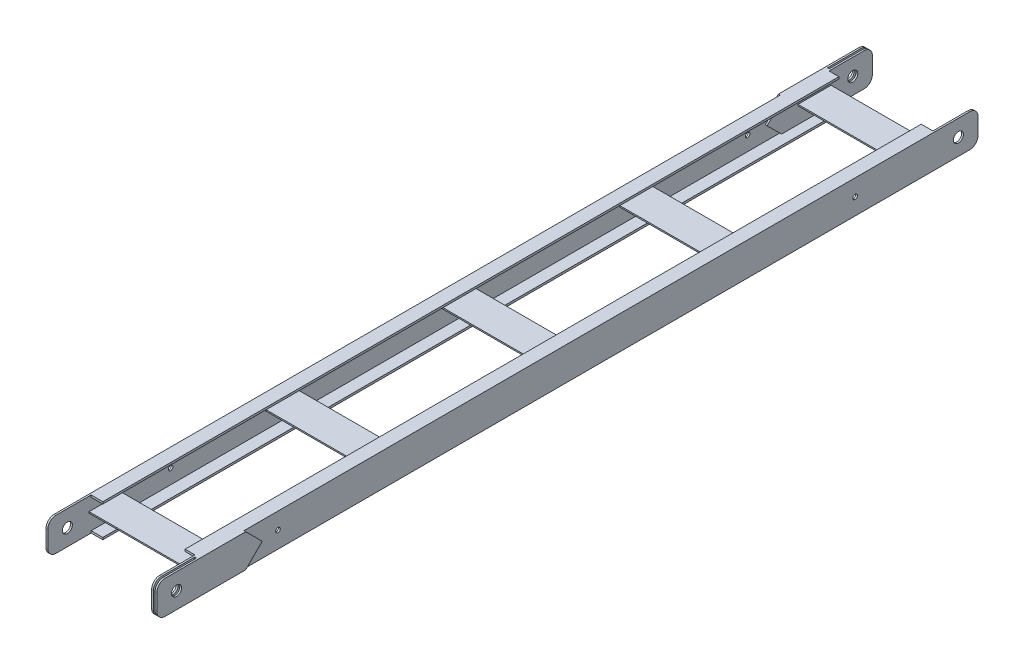
from build123d import *

# Parameters (mm, degrees)
EXTRUDE_1_DEPTH        = 3985
EXTRUDE_1_2_DEPTH      = 3985
EXTRUDE_3_DEPTH        = 520
SKETCH_6_W             = 511.5
SKETCH_6_H             = 200
CUT_EXTRUDE_4_DEPTH    = 4024.075595859
PATTERN_LINEAR_1_COUNT = 5
PATTERN_LINEAR_1_PITCH = 856.25
EXTRUDE_11_DEPTH       = 8.5
PATTERN_LINEAR_2_COUNT = 2
PATTERN_LINEAR_2_PITCH = 17
SKETCH_22_W            = 8.5
SKETCH_22_H            = 200
CUT_EXTRUDE_12_DEPTH   = 4025.201038716
SKETCH_23_R            = 24.25
CUT_EXTRUDE_13_DEPTH   = 4025.201038716
EXTRUDE_14_DEPTH       = 8.5
PATTERN_LINEAR_3_COUNT = 2
PATTERN_LINEAR_3_PITCH = 17
SKETCH_27_W            = 8.5
SKETCH_27_H            = 200
CUT_EXTRUDE_15_DEPTH   = 4025.201038716
SKETCH_28_R            = 24.25
CUT_EXTRUDE_16_DEPTH   = 4026.344115725
FILLET_2_R             = 40
SKETCH_29_W            = 503
SKETCH_29_H            = 10
CUT_EXTRUDE_17_DEPTH   = 10
SKETCH_30_W            = 503
SKETCH_30_H            = 10
CUT_EXTRUDE_18_DEPTH   = 10
SKETCH_31_R            = 11
CUT_EXTRUDE_19_DEPTH   = 4025.201038716


with BuildPart() as part:
    # 草图2 → 拉伸1 (new body)
    with BuildSketch(Plane.XY):
        Polygon((0, 0), (0, 160), (65, 160), (65, 150), (8.5, 150), (8.5, 10), (65, 10), (65, 0), align=None)
    extrude(amount=EXTRUDE_1_DEPTH)



with BuildPart() as body_2:
    # 草图2 → Extrude 1 2 (new body)
    with BuildSketch(Plane.XY):
        Polygon((463.5, 160), (528.5, 160), (528.5, 0), (463.5, 0), (463.5, 10), (520, 10), (520, 150), (463.5, 150), align=None)
    extrude(amount=EXTRUDE_1_2_DEPTH)


with BuildPart() as part_1:
    add(part.part)

    add(body_2.part)  # 拉伸3 merges body 2
    # 草图5 → 拉伸3 (add)
    with BuildSketch(Plane.ZY):
        Polygon((200, 95), (360, 95), (360, 88.5), (283.25, 88.5), (283.25, 48.5), (276.75, 48.5), (276.75, 88.5), (200, 88.5), align=None)
    extrude_3 = extrude(amount=-EXTRUDE_3_DEPTH)

    # 草图6 → 拉伸4 (cut, through all)
    with BuildSketch(Plane(origin=(0, 160, 0), x_dir=(1, 0, 0), z_dir=(0, 1, 0))):
        with Locations((264.25, -100)):
            Rectangle(SKETCH_6_W, SKETCH_6_H)
        with Locations((264.25, -3885)):
            Rectangle(SKETCH_6_W, SKETCH_6_H)
    extrude(amount=-CUT_EXTRUDE_4_DEPTH, mode=Mode.SUBTRACT)

    # 阵列(线性)1: 拉伸3 ×5
    with Locations(*[(0, 0, i * PATTERN_LINEAR_1_PITCH) for i in range(1, PATTERN_LINEAR_1_COUNT)]):
        add(extrude_3)

    # 草图19 → 拉伸11 (add)
    with BuildSketch(Plane(origin=(528.5, 0, 0), x_dir=(0, 0, -1), z_dir=(1, 0, 0))):
        Polygon((-3985, 160), (-3555, 160), (-3475, 80), (-3555, 0), (-3985, 0), align=None)
    extrude_11 = extrude(amount=EXTRUDE_11_DEPTH)

    # 阵列(线性)2: 拉伸11 ×2
    with Locations(*[(-i * PATTERN_LINEAR_2_PITCH, 0, 0) for i in range(1, PATTERN_LINEAR_2_COUNT)]):
        add(extrude_11)

    # 草图22 → 拉伸12 (cut, through all)
    with BuildSketch(Plane(origin=(0, 160, 0), x_dir=(1, 0, 0), z_dir=(0, 1, 0))):
        with Locations((524.25, -3885)):
            Rectangle(SKETCH_22_W, SKETCH_22_H)
    extrude(amount=-CUT_EXTRUDE_12_DEPTH, mode=Mode.SUBTRACT)

    # 草图23 → 拉伸13 (cut, through all)
    with BuildSketch(Plane.ZY):
        with Locations((95, 80)):
            Circle(SKETCH_23_R)
        with Locations(Location((3890, 80, 0), (0, 0, 180))):
            Circle(SKETCH_23_R)
    extrude(amount=-CUT_EXTRUDE_13_DEPTH, mode=Mode.SUBTRACT)

    # 草图26 → 拉伸14 (add)
    with BuildSketch(Plane.ZY):
        Polygon((0, 160), (0, 0), (430, 0), (510, 80), (430, 160), align=None)
    extrude_14 = extrude(amount=EXTRUDE_14_DEPTH)

    # 阵列(线性)3: 拉伸14 ×2
    with Locations(*[(i * PATTERN_LINEAR_3_PITCH, 0, 0) for i in range(1, PATTERN_LINEAR_3_COUNT)]):
        add(extrude_14)

    # 草图27 → 拉伸15 (cut, through all)
    with BuildSketch(Plane(origin=(0, 160, 0), x_dir=(1, 0, 0), z_dir=(0, 1, 0))):
        with Locations((4.25, -100)):
            Rectangle(SKETCH_27_W, SKETCH_27_H)
    extrude(amount=-CUT_EXTRUDE_15_DEPTH, mode=Mode.SUBTRACT)

    # 草图28 → 拉伸16 (cut, through all)
    with BuildSketch(Plane.ZY.offset(8.5)):
        with Locations((95, 80)):
            Circle(SKETCH_28_R)
    extrude(amount=-CUT_EXTRUDE_16_DEPTH, mode=Mode.SUBTRACT)

    # 圆角2
    fillet_2_edges = [part_1.edges().sort_by_distance(p)[0] for p in [
        (-4.25, 0, 0),
        (515.75, 0, 3985),
        (4.25, 160, 3985),
        (515.75, 160, 3985),
        (532.75, 0, 3985),
        (4.25, 0, 3985),
        (-4.25, 160, 0),
        (12.75, 0, 0),
        (524.25, 160, 0),
        (532.75, 160, 3985),
        (524.25, 0, 0),
        (12.75, 160, 0),
    ]]
    fillet(fillet_2_edges, radius=FILLET_2_R)

    # 草图29 → 拉伸17 (cut)
    with BuildSketch(Plane.XY.offset(3785)):
        with Locations((260, 155)):
            Rectangle(SKETCH_29_W, SKETCH_29_H)
        with Locations((260, 5)):
            Rectangle(SKETCH_29_W, SKETCH_29_H)
    extrude(amount=-CUT_EXTRUDE_17_DEPTH, mode=Mode.SUBTRACT)

    # 草图30 → 拉伸18 (cut)
    with BuildSketch(Plane(origin=(0, 0, 200), x_dir=(-1, 0, 0), z_dir=(0, 0, -1))):
        with Locations((-268.5, 155)):
            Rectangle(SKETCH_30_W, SKETCH_30_H)
        with Locations((-268.5, 5)):
            Rectangle(SKETCH_30_W, SKETCH_30_H)
    extrude(amount=-CUT_EXTRUDE_18_DEPTH, mode=Mode.SUBTRACT)

    # 草图31 → 拉伸19 (cut, through all)
    with BuildSketch(Plane(origin=(528.5, 0, 0), x_dir=(0, 0, -1), z_dir=(1, 0, 0))):
        with Locations((-595, 80)):
            Circle(SKETCH_31_R)
        with Locations((-3390, 80)):
            Circle(SKETCH_31_R)
    extrude(amount=-CUT_EXTRUDE_19_DEPTH, mode=Mode.SUBTRACT)


solid = part_1.part
